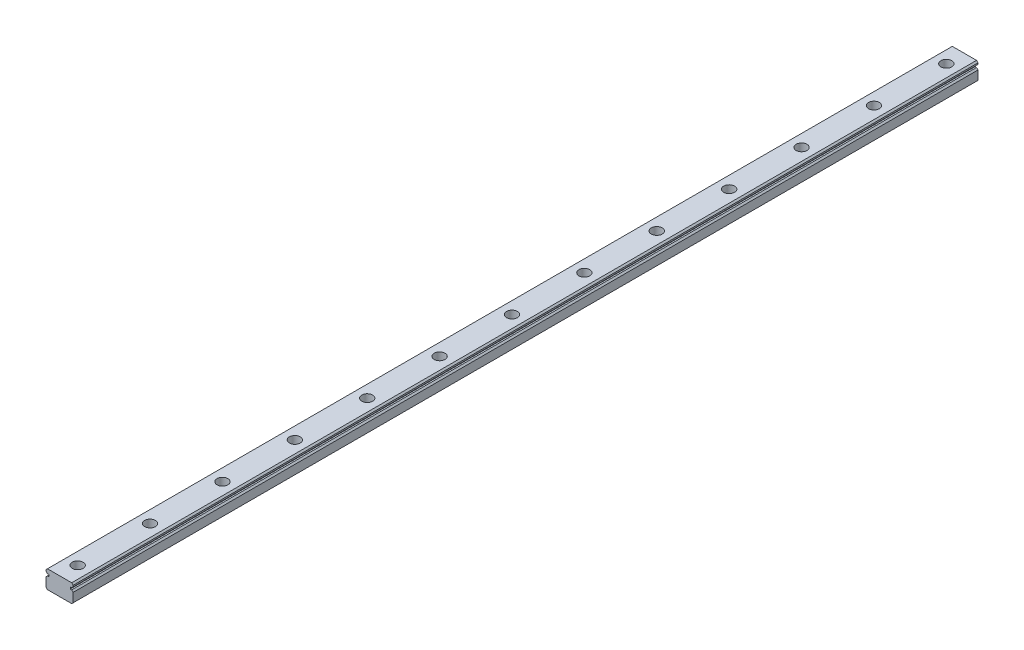
from build123d import *

# Parameters (mm, degrees)
BOSS_EXTRUDE1_DEPTH = 500
SKETCH4_R           = 3
CUT_EXTRUDE1_DEPTH  = 4.5
SKETCH6_R           = 1.75
CUT_EXTRUDE2_DEPTH  = 501.086492519
LPATTERN1_COUNT     = 13
LPATTERN1_PITCH     = 40


with BuildPart() as part:
    # Sketch1 → Boss-Extrude1 (new body)
    with BuildSketch(Plane.XY):
        Polygon((6.7, 5), (-6.7, 5), (-7.5, 4.2), (-7.5, 3.4), (-6.7, 2.6), (-5.9, 2.6), (-5.9, 1.6), (-6.7, 1.6), (-7.5, 0.8), (-7.5, -4.2), (-6.7, -5), (6.7, -5), (7.5, -4.2), (7.5, 0.8), (6.7, 1.6), (5.9, 1.6), (5.9, 2.6), (6.7, 2.6), (7.5, 3.4), (7.5, 4.2), align=None)
    extrude(amount=BOSS_EXTRUDE1_DEPTH)

    # Sketch4 → Cut-Extrude1 (cut)
    with BuildSketch(Plane(origin=(0, 5, 0), x_dir=(1, 0, 0), z_dir=(0, 1, 0))):
        with Locations(Location((0, -10, 0), (0, 0, 270))):
            Circle(SKETCH4_R)
    cut_extrude1 = extrude(amount=-CUT_EXTRUDE1_DEPTH, mode=Mode.SUBTRACT)

    # Sketch6 → Cut-Extrude2 (cut, through all)
    with BuildSketch(Plane(origin=(0, 0.5, 0), x_dir=(1, 0, 0), z_dir=(0, 1, 0))):
        with Locations(Location((0, -10, 0), (0, 0, 270))):
            Circle(SKETCH6_R)
    cut_extrude2 = extrude(amount=-CUT_EXTRUDE2_DEPTH, mode=Mode.SUBTRACT)

    # LPattern1: Cut-Extrude1, Cut-Extrude2 ×13
    with Locations(*[(0, 0, i * LPATTERN1_PITCH) for i in range(1, LPATTERN1_COUNT)]):
        add(cut_extrude1, mode=Mode.SUBTRACT)
        add(cut_extrude2, mode=Mode.SUBTRACT)


solid = part.part
